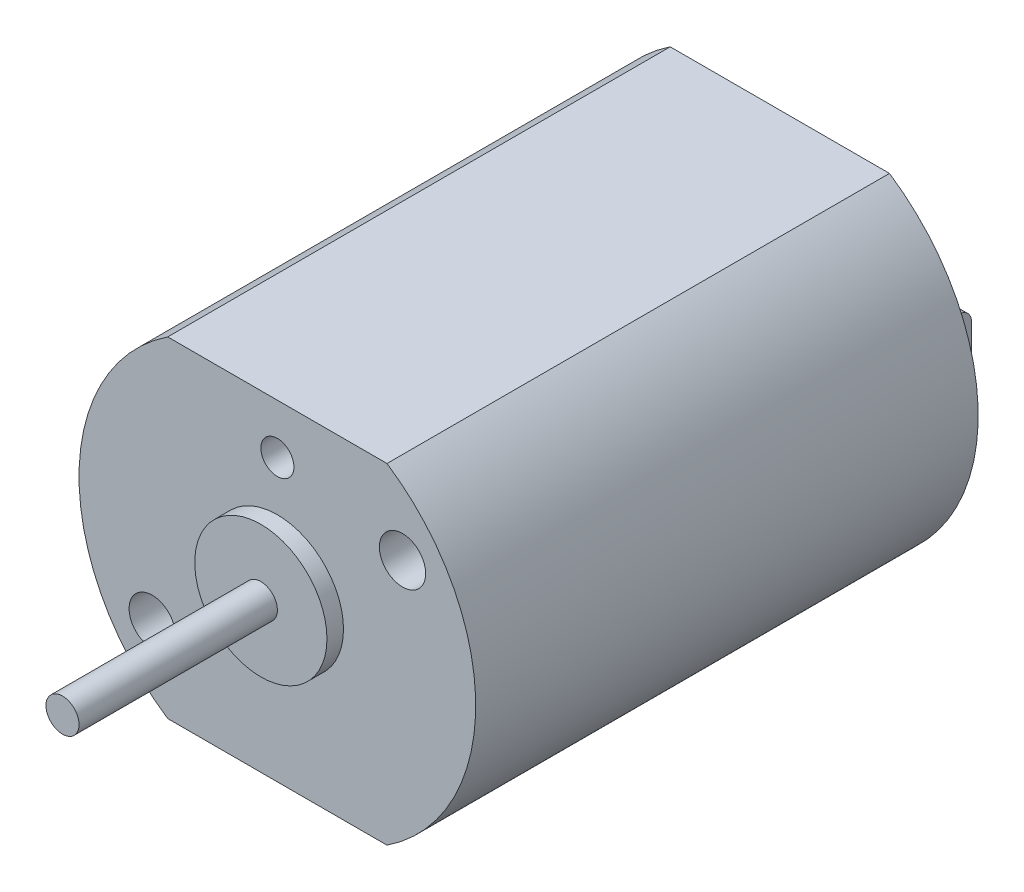
from build123d import *

# Parameters (mm, degrees)
SKETCH_1_W          = 0.3
SKETCH_1_H          = 1.5
SKETCH_1_R          = 2.5
SKETCH_1_R_2        = 1.5
EXTRUDE_1_DEPTH     = 15.2
SKETCH_1_4_W        = 0.3
SKETCH_1_4_H        = 1.5
EXTRUDE_2_DEPTH     = 2
CUT_EXTRUDE_2_DEPTH = 19.763794925
FILLET_1_R          = 0.4
SKETCH_1_5_R        = 2.5
SKETCH_1_5_R_2      = 1.5
EXTRUDE_3_DEPTH     = 1.2
CUT_EXTRUDE_START   = -1.2
SKETCH_1_7_R        = 1.5
CUT_EXTRUDE_1_DEPTH = 0.6
FILLET_2_R          = 0.4
SKETCH_3_R          = 2
EXTRUDE_4_DEPTH     = 0.5
SKETCH_3_3_R        = 0.5
EXTRUDE_5_DEPTH     = 6.5
SKETCH_4_R          = 0.7
SKETCH_4_R_2        = 0.5
CUT_EXTRUDE_3_DEPTH = 1


with BuildPart() as part:
    # 草图1 → 凸台-拉伸1 (new body)
    # profile 1 of 5: a face of its own
    with BuildSketch(Plane.XY):
        with BuildLine():
            ThreePointArc((-6, 0), (-5.286764074, -2.837274331), (-3.31662479, -5))
            Line((-3.31662479, -5), (3.31662479, -5))
            ThreePointArc((3.31662479, -5), (5.286764074, -2.837274331), (6, 0))
            ThreePointArc((6, 0), (5.286764074, 2.837274331), (3.31662479, 5))
            Line((3.31662479, 5), (-3.31662479, 5))
            ThreePointArc((-3.31662479, 5), (-5.286764074, 2.837274331), (-6, 0))
        make_face()
        with Locations((-3.65, 0)):
            Rectangle(SKETCH_1_W, SKETCH_1_H, mode=Mode.SUBTRACT)
        Circle(SKETCH_1_R, mode=Mode.SUBTRACT)
        with Locations((3.65, 0)):
            Rectangle(SKETCH_1_W, SKETCH_1_H, mode=Mode.SUBTRACT)
    # profile 2 of 5: a face of its own
    with BuildSketch(Plane.XY):
        Circle(SKETCH_1_R)
        Circle(SKETCH_1_R_2, mode=Mode.SUBTRACT)
    # profile 3 of 5: a face of its own
    with BuildSketch(Plane.XY):
        Circle(SKETCH_1_R_2)
    # profile 4 of 5: a face of its own
    with BuildSketch(Plane.XY):
        with Locations((3.65, 0)):
            Rectangle(SKETCH_1_W, SKETCH_1_H)
    # profile 5 of 5: a face of its own
    with BuildSketch(Plane.XY):
        with Locations((-3.65, 0)):
            Rectangle(SKETCH_1_W, SKETCH_1_H)
    extrude(amount=EXTRUDE_1_DEPTH)

    # 草图1<4> → 凸台-拉伸2 (add)
    with BuildSketch(Plane.XY):
        with Locations((3.65, 0)):
            Rectangle(SKETCH_1_4_W, SKETCH_1_4_H)
        with Locations((-3.65, 0)):
            Rectangle(SKETCH_1_4_W, SKETCH_1_4_H)
    extrude(amount=-EXTRUDE_2_DEPTH)

    # 草图2 → 切除-拉伸2 (cut, through all)
    with BuildSketch(Plane(origin=(3.8, 0, 0), x_dir=(0, 0, -1), z_dir=(1, 0, 0))):
        with BuildLine():
            Line((0.95, 0.45), (1.05, 0.45))
            ThreePointArc((1.05, 0.45), (1.5, 0), (1.05, -0.45))
            Line((1.05, -0.45), (0.95, -0.45))
            ThreePointArc((0.95, -0.45), (0.5, 0), (0.95, 0.45))
        make_face()
    extrude(amount=-CUT_EXTRUDE_2_DEPTH, mode=Mode.SUBTRACT)

    # 圆角1
    fillet_1_edges = [part.edges().sort_by_distance(p)[0] for p in [
        (3.65, -0.75, -2),
        (3.65, 0.75, -2),
        (-3.65, -0.75, -2),
        (-3.65, 0.75, -2),
    ]]
    fillet(fillet_1_edges, radius=FILLET_1_R)

    # 草图1<5> → 凸台-拉伸3 (add)
    # profile 1 of 2: a face of its own
    with BuildSketch(Plane.XY):
        Circle(SKETCH_1_5_R)
        Circle(SKETCH_1_5_R_2, mode=Mode.SUBTRACT)
    # profile 2 of 2: a face of its own
    with BuildSketch(Plane.XY):
        Circle(SKETCH_1_5_R_2)
    extrude(amount=-EXTRUDE_3_DEPTH)

    # 草图1<7> → 切除-拉伸1 (cut)
    with BuildSketch(Plane.XY.offset(CUT_EXTRUDE_START)):
        Circle(SKETCH_1_7_R)
    extrude(amount=CUT_EXTRUDE_1_DEPTH, mode=Mode.SUBTRACT)

    # 圆角2
    fillet_2_edges = [part.edges().sort_by_distance(p)[0] for p in [
        (-2.5, 0, -1.2),
    ]]
    fillet(fillet_2_edges, radius=FILLET_2_R)

    # 草图3 → 凸台-拉伸4 (add)
    with BuildSketch(Plane.XY.offset(15.2)):
        Circle(SKETCH_3_R)
    extrude(amount=EXTRUDE_4_DEPTH)

    # 草图3<3> → 凸台-拉伸5 (add)
    with BuildSketch(Plane.XY.offset(15.2)):
        Circle(SKETCH_3_3_R)
    extrude(amount=EXTRUDE_5_DEPTH)

    # 草图4 → 切除-拉伸3 (cut)
    with BuildSketch(Plane.XY.offset(15.2)):
        with Locations((-3.785828839, -2.7)):
            Circle(SKETCH_4_R)
        with Locations((3.785828839, 2.7)):
            Circle(SKETCH_4_R)
        with Locations((0, 3.5)):
            Circle(SKETCH_4_R_2)
    extrude(amount=-CUT_EXTRUDE_3_DEPTH, mode=Mode.SUBTRACT)


solid = part.part
